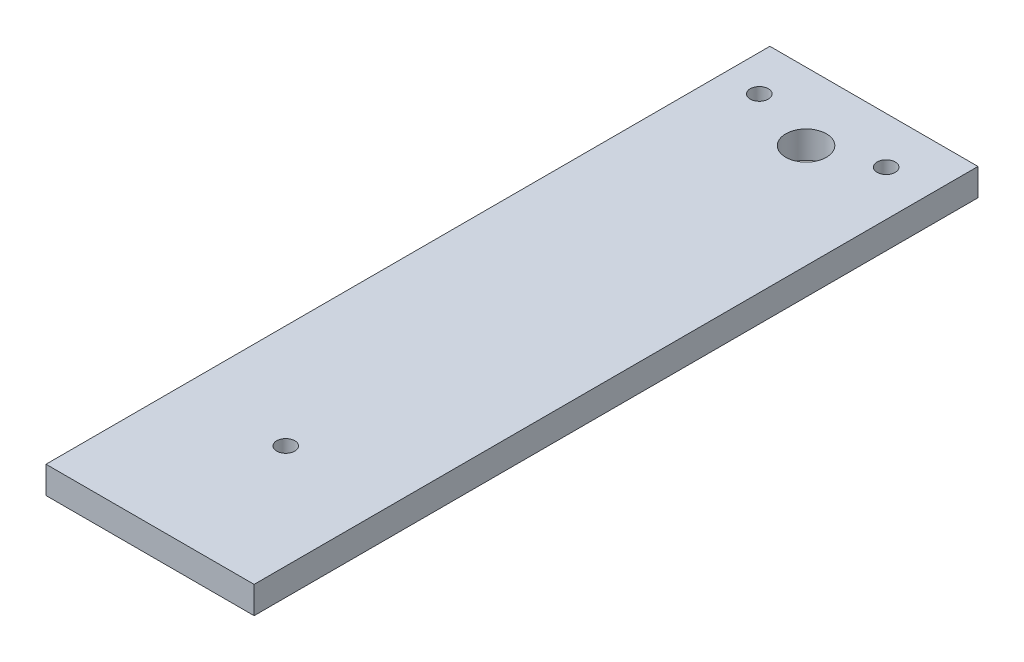
from build123d import *

# Parameters (mm, degrees)
ESQUISSE1_W             = 23
ESQUISSE1_H             = 3
BOSS_EXTRU_1_DEPTH      = 80
ESQUISSE3_R             = 1
ENL_V_MAT_EXTRU_2_DEPTH = 10
ESQUISSE4_R             = 1
ENL_V_MAT_EXTRU_3_DEPTH = 10
ESQUISSE5_R             = 2.25
ENL_V_MAT_EXTRU_4_DEPTH = 81.877994535


with BuildPart() as part:
    # Esquisse1 → Boss.-Extru.1 (new body)
    with BuildSketch(Plane.XY):
        Rectangle(ESQUISSE1_W, ESQUISSE1_H)
    extrude(amount=BOSS_EXTRU_1_DEPTH)

    # Esquisse3 → Enlèv. mat.-Extru.2 (cut)
    with BuildSketch(Plane.XZ.offset(1.5)):
        with Locations((0, 65)):
            Circle(ESQUISSE3_R)
    extrude(amount=-ENL_V_MAT_EXTRU_2_DEPTH, mode=Mode.SUBTRACT)

    # Esquisse4 → Enlèv. mat.-Extru.3 (cut)
    with BuildSketch(Plane(origin=(0, -1.5, 0), x_dir=(-1, 0, 0), z_dir=(0, -1, 0))):
        with Locations(Location((-6.497330661, -5.144161138, 0), (0, 0, 180))):
            Circle(ESQUISSE4_R)
        with Locations(Location((7.524836603, -5.144161138, 0), (0, 0, 180))):
            Circle(ESQUISSE4_R)
    extrude(amount=-ENL_V_MAT_EXTRU_3_DEPTH, mode=Mode.SUBTRACT)

    # Esquisse5 → Enlèv. mat.-Extru.4 (cut, through all)
    with BuildSketch(Plane(origin=(0, 1.5, 0), x_dir=(1, 0, 0), z_dir=(0, 1, 0))):
        with Locations(Location((0, -7.5, 0), (0, 0, 180))):
            Circle(ESQUISSE5_R)
    extrude(amount=-ENL_V_MAT_EXTRU_4_DEPTH, mode=Mode.SUBTRACT)


solid = part.part
